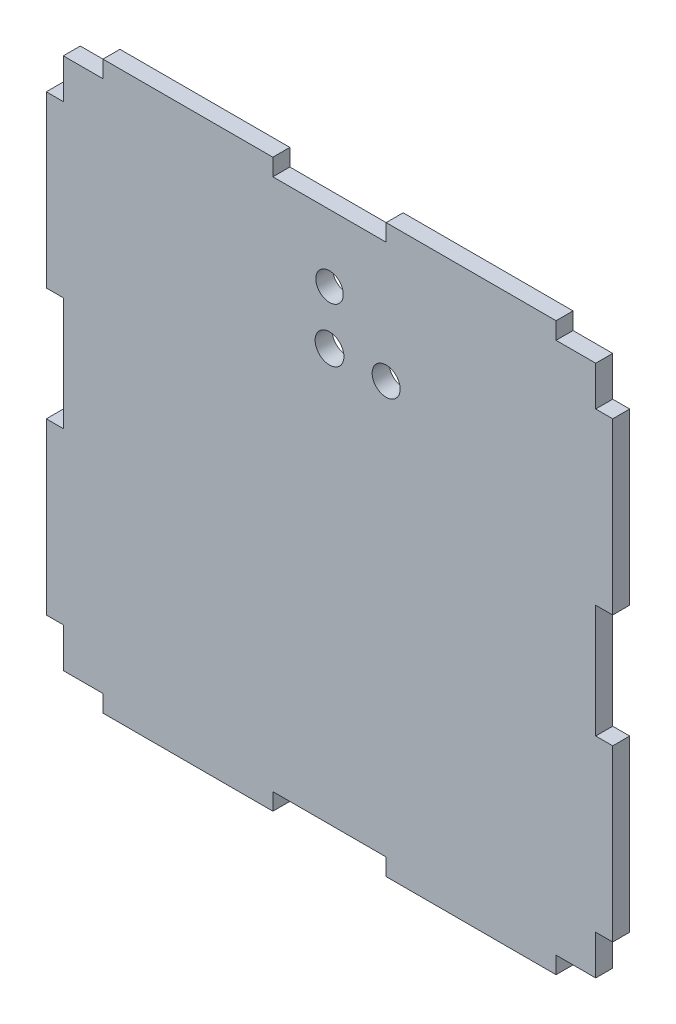
from build123d import *

# Parameters (mm, degrees)
ESQUISSE1_R        = 2.544536974
ESQUISSE1_R_2      = 2.470557968
ESQUISSE1_R_3      = 2.428661445
BOSS_EXTRU_1_DEPTH = 3


with BuildPart() as part:
    # Esquisse1 → Boss.-Extru.1 (new body)
    with BuildSketch(Plane.XY):
        Polygon((19.258166425, 80.200130208), (-10.741833575, 80.200130208), (-10.741833575, 77.200130208), (-30.741833575, 77.200130208), (-30.741833575, 80.200130208), (-60.741833575, 80.200130208), (-60.741833575, 77.200130208), (-67.741833575, 77.200130208), (-67.741833575, 70.200130208), (-70.741833575, 70.200130208), (-70.741833575, 40.200130208), (-67.741833575, 40.200130208), (-67.741833575, 20.200130208), (-70.741833575, 20.200130208), (-70.741833575, -9.799869792), (-67.741833575, -9.799869792), (-67.741833575, -16.799869792), (-60.741833575, -16.799869792), (-60.741833575, -19.799869792), (-30.741833575, -19.799869792), (-30.741833575, -16.799869792), (-10.741833575, -16.799869792), (-10.741833575, -19.799869792), (19.258166425, -19.799869792), (19.258166425, -16.799869792), (26.258166425, -16.799869792), (26.258166425, -9.799869792), (29.258166425, -9.799869792), (29.258166425, 20.200130208), (26.258166425, 20.200130208), (26.258166425, 40.200130208), (29.258166425, 40.200130208), (29.258166425, 70.200130208), (26.258166425, 70.200130208), (26.258166425, 77.200130208), (19.258166425, 77.200130208), align=None)
        with Locations((-20.741833575, 55.962168499)):
            Circle(ESQUISSE1_R, mode=Mode.SUBTRACT)
        with Locations((-10.741833575, 55.962168499)):
            Circle(ESQUISSE1_R_2, mode=Mode.SUBTRACT)
        with Locations((-20.741833575, 65.411454145)):
            Circle(ESQUISSE1_R_3, mode=Mode.SUBTRACT)
    extrude(amount=BOSS_EXTRU_1_DEPTH)


solid = part.part
